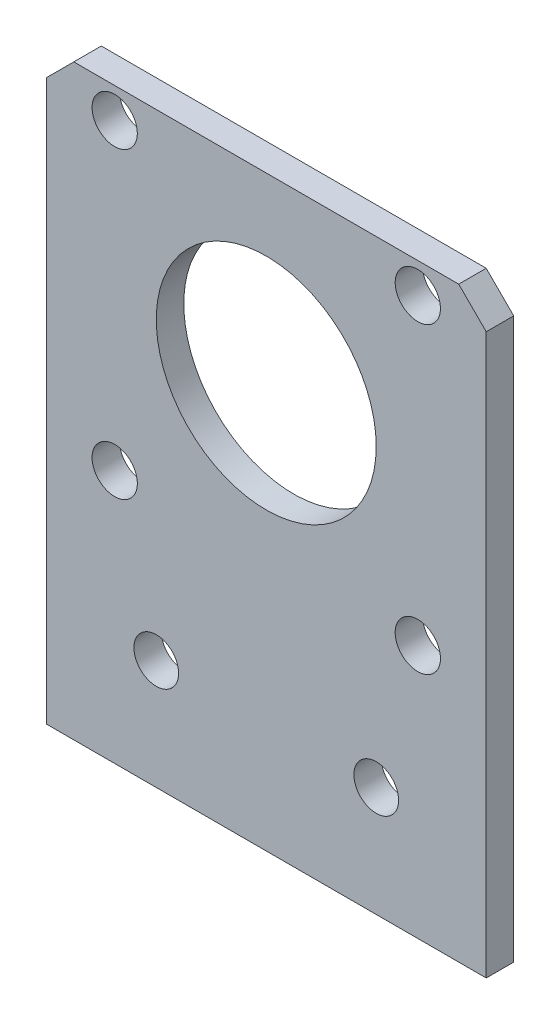
from build123d import *

# Parameters (mm, degrees)
SKETCH1_W           = 50.8
SKETCH1_H           = 67.8
SKETCH1_R           = 2.58125
SKETCH1_R_2         = 12.7
SKETCH1_R_3         = 2.613
BOSS_EXTRUDE1_DEPTH = 3.175
CHAMFER1_SIZE       = 3.175


with BuildPart() as part:
    # Sketch1 → Boss-Extrude1 (new body)
    with BuildSketch(Plane.XY):
        with Locations((-25.4, 33.9)):
            Rectangle(SKETCH1_W, SKETCH1_H)
        with Locations((-38.1, 12.7)):
            Circle(SKETCH1_R, mode=Mode.SUBTRACT)
        with Locations(Location((-12.7, 12.7, 0), (0, 0, 180))):
            Circle(SKETCH1_R, mode=Mode.SUBTRACT)
        with Locations((-25.4, 46.8)):
            Circle(SKETCH1_R_2, mode=Mode.SUBTRACT)
        with Locations((-42.9, 64.3)):
            Circle(SKETCH1_R_3, mode=Mode.SUBTRACT)
        with Locations(Location((-7.9, 64.3, 0), (0, 0, 180))):
            Circle(SKETCH1_R_3, mode=Mode.SUBTRACT)
        with Locations((-7.9, 29.3)):
            Circle(SKETCH1_R_3, mode=Mode.SUBTRACT)
        with Locations(Location((-42.9, 29.3, 0), (0, 0, 180))):
            Circle(SKETCH1_R_3, mode=Mode.SUBTRACT)
    extrude(amount=BOSS_EXTRUDE1_DEPTH)

    # Chamfer1
    chamfer1_edges = [part.edges().sort_by_distance(p)[0] for p in [
        (-50.8, 67.8, 1.5875),
        (0, 67.8, 1.5875),
    ]]
    chamfer(chamfer1_edges, length=CHAMFER1_SIZE)


solid = part.part
